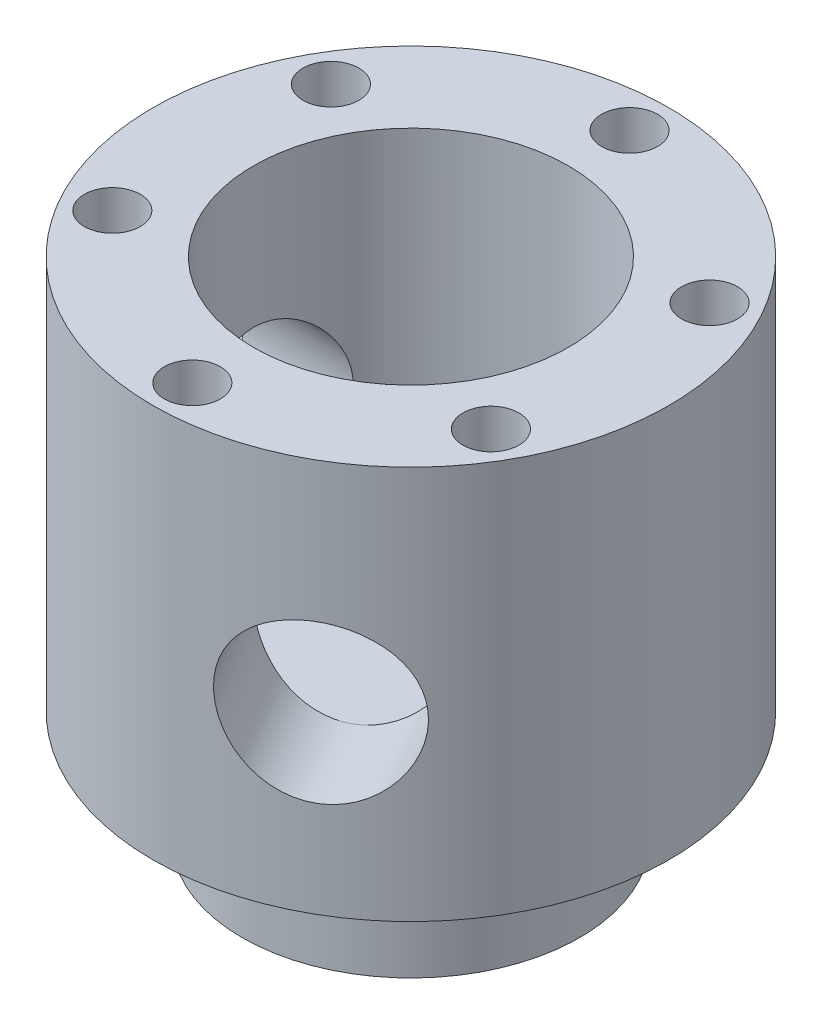
from build123d import *
from build123d.topology import SkipClean

# Parameters (mm, degrees)
SKETCH_1_R               = 14.75
EXTRUDE_1_DEPTH          = 22.5
SKETCH_3_R               = 1.6
CUT_EXTRUDE_1_DEPTH      = 31.681835017
SKETCH_5_R               = 9.65
EXTRUDE_2_DEPTH          = 6.4
SKETCH_6_R               = 9
CUT_EXTRUDE_2_DEPTH      = 17
SKETCH_9_R               = 4.5
CUT_EXTRUDE_3_DEPTH      = 31.681835017
PATTERN_CIRCULAR_1_COUNT = 3


with BuildPart() as part:
    # 草图1 → 凸台-拉伸1 (new body)
    with BuildSketch(Plane(origin=(0, 0, 0), x_dir=(1, 0, 0), z_dir=(0, 1, 0))):
        with Locations(Location((0, 0, 0), (0, 0, 90))):
            Circle(SKETCH_1_R)
    extrude(amount=EXTRUDE_1_DEPTH)

    # 草图3 → 切除-拉伸1 (cut, through all)
    with BuildSketch(Plane(origin=(0, 0, 0), x_dir=(1, 0, 0), z_dir=(0, 1, 0))):
        with Locations(Location((0, 12.5, 0), (0, 0, 90))):
            Circle(SKETCH_3_R)
        with Locations(Location((10.825317547, 6.25, 0), (0, 0, 90))):
            Circle(SKETCH_3_R)
        with Locations(Location((10.825317547, -6.25, 0), (0, 0, 90))):
            Circle(SKETCH_3_R)
        with Locations(Location((0, -12.5, 0), (0, 0, 90))):
            Circle(SKETCH_3_R)
        with Locations(Location((-10.825317547, -6.25, 0), (0, 0, 90))):
            Circle(SKETCH_3_R)
        with Locations(Location((-10.825317547, 6.25, 0), (0, 0, 90))):
            Circle(SKETCH_3_R)
    extrude(amount=CUT_EXTRUDE_1_DEPTH, mode=Mode.SUBTRACT)

    # 草图5 → 凸台-拉伸2 (add)
    with BuildSketch(Plane.XZ):
        with Locations(Location((0, 0, 0), (0, 0, 90))):
            Circle(SKETCH_5_R)
    extrude(amount=EXTRUDE_2_DEPTH)

    # 草图6 → 切除-拉伸2 (cut)
    with BuildSketch(Plane(origin=(0, 22.5, 0), x_dir=(1, 0, 0), z_dir=(0, 1, 0))):
        with Locations(Location((0, 0, 0), (0, 0, 270))):
            Circle(SKETCH_6_R)
    extrude(amount=-CUT_EXTRUDE_2_DEPTH, mode=Mode.SUBTRACT)

    # 草图9 → 切除-拉伸3 (cut, through all)
    with BuildSketch(Plane(origin=(0, 0, 0), x_dir=(0, 0, -1), z_dir=(1, 0, 0))):
        with Locations(Location((0, 10, 0), (0, 0, 270))):
            Circle(SKETCH_9_R)
    cut_extrude_3 = extrude(amount=-CUT_EXTRUDE_3_DEPTH, mode=Mode.SUBTRACT)

    # 阵列(圆周)1: 切除-拉伸3 ×3 about axis
    with SkipClean():  # the faces are left unmerged after this step: merging them gives an invalid solid
        pattern_circular_1_axis = Axis((0, 22.5, 0), (0, 1, 0))
        for i in range(1, PATTERN_CIRCULAR_1_COUNT):
            add(cut_extrude_3.rotate(pattern_circular_1_axis, i * 360 / PATTERN_CIRCULAR_1_COUNT), mode=Mode.SUBTRACT)


solid = part.part
